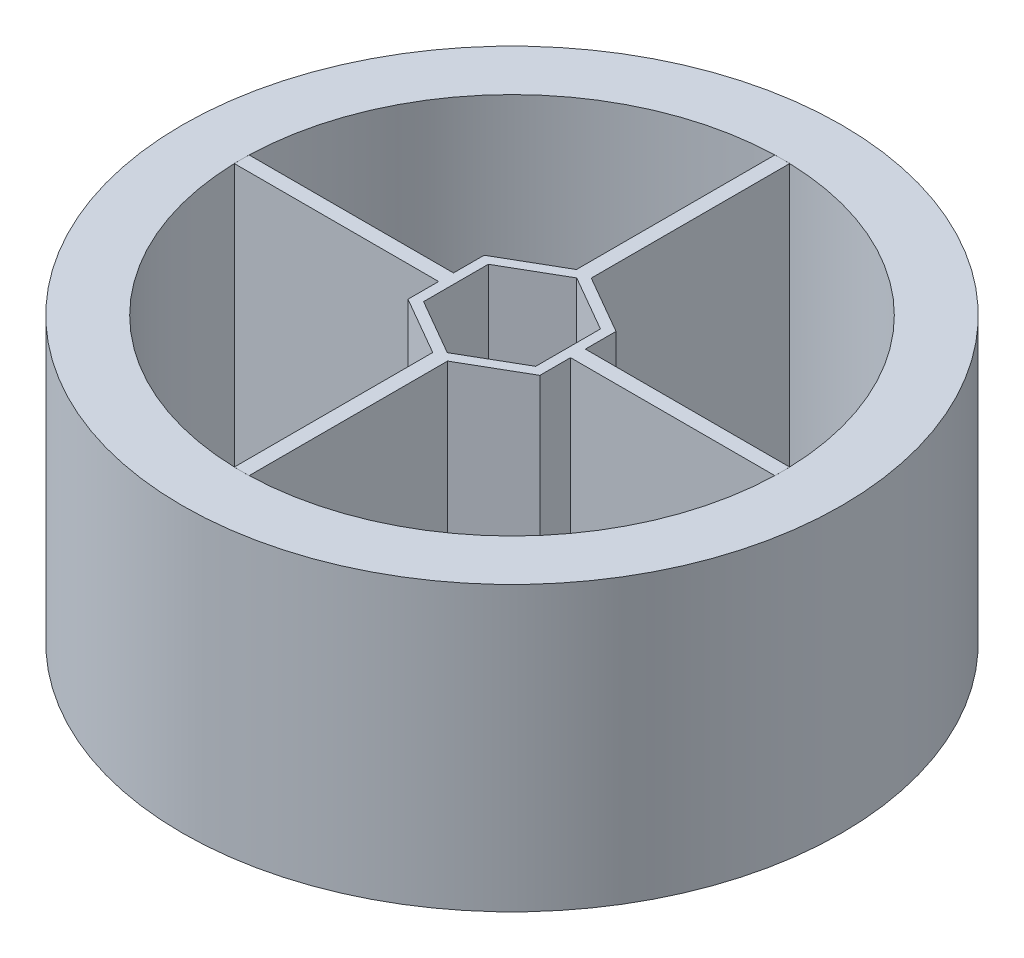
from build123d import *

# Parameters (mm, degrees)
MAIN_WHEEL_DEPTH   = 43
SKETCH1_R          = 50
MAIN_WHEEL_2_DEPTH = 43
HEX_BORE_DEPTH     = 23
SKETCH3_R          = 2.5
MOTOR_BORE_DEPTH   = 75.35724578


with BuildPart() as part:
    # Sketch1 → main-wheel (new body)
    with BuildSketch(Plane(origin=(0, 0, 0), x_dir=(1, 0, 0), z_dir=(0, 1, 0))):
        with BuildLine():
            Line((-1.125, -10.897486331), (-1.125, -40.984562643))
            ThreePointArc((-1.125, -40.984562643), (-0.562552934, -40.996140479), (4.4e-08, -41))
            ThreePointArc((4.4e-08, -41), (0.562552978, -40.996140479), (1.125, -40.984562643))
            Line((1.125, -40.984562643), (1.125, -10.897486331))
            Line((1.125, -10.897486331), (10, -5.773502692))
            Line((10, -5.773502692), (10, -1.125))
            Line((10, -1.125), (40.984562643, -1.125))
            ThreePointArc((40.984562643, -1.125), (40.996140479, -0.562552956), (41, 0))
            ThreePointArc((41, 0), (40.996140479, 0.562552956), (40.984562643, 1.125))
            Line((40.984562643, 1.125), (10, 1.125))
            Line((10, 1.125), (10, 5.773502692))
            Line((10, 5.773502692), (1.125, 10.897486331))
            Line((1.125, 10.897486331), (1.125, 40.984562643))
            ThreePointArc((1.125, 40.984562643), (0.562552956, 40.996140479), (0, 41))
            ThreePointArc((0, 41), (-0.562552956, 40.996140479), (-1.125, 40.984562643))
            Line((-1.125, 40.984562643), (-1.125, 10.897486331))
            Line((-1.125, 10.897486331), (-10, 5.773502692))
            Line((-10, 5.773502692), (-10, 1.125))
            Line((-10, 1.125), (-40.984562643, 1.125))
            ThreePointArc((-40.984562643, 1.125), (-40.996140481, 0.562552814), (-41, -2.83e-07))
            ThreePointArc((-41, -2.83e-07), (-40.996140477, -0.562553097), (-40.984562643, -1.125))
            Line((-40.984562643, -1.125), (-10, -1.125))
            Line((-10, -1.125), (-10, -5.773502692))
            Line((-10, -5.773502692), (-1.125, -10.897486331))
        make_face()
    extrude(amount=MAIN_WHEEL_DEPTH)

    # Sketch2 → hex-bore (cut)
    with BuildSketch(Plane(origin=(0, 43, 0), x_dir=(1, 0, 0), z_dir=(0, 1, 0))):
        Polygon((0, -9.814954576), (8.5, -4.907477288), (8.5, 4.907477288), (0, 9.814954576), (-8.5, 4.907477288), (-8.5, -4.907477288), align=None)
    extrude(amount=-HEX_BORE_DEPTH, mode=Mode.SUBTRACT)

    # Sketch3 → motor-bore (cut, through all)
    with BuildSketch(Plane(origin=(0, 20, 0), x_dir=(1, 0, 0), z_dir=(0, 1, 0))):
        with Locations(Location((0, 0, 0), (0, 0, 270))):
            Circle(SKETCH3_R)
    extrude(amount=-MOTOR_BORE_DEPTH, mode=Mode.SUBTRACT)


with BuildPart() as body_2:
    # Sketch1 → main-wheel 2 (new body)
    with BuildSketch(Plane(origin=(0, 0, 0), x_dir=(1, 0, 0), z_dir=(0, 1, 0))):
        with Locations(Location((0, 0, 0), (0, 0, 270))):
            Circle(SKETCH1_R)
        with BuildLine():
            Line((4.4e-08, -41), (-1.125, -41))
            Line((-1.125, -41), (-1.125, -40.984562643))
            ThreePointArc((-1.125, -40.984562643), (-28.991378029, -28.991378029), (-40.984562643, -1.125))
            Line((-40.984562643, -1.125), (-41, -1.125))
            Line((-41, -1.125), (-41, -2.83e-07))
            Line((-41, -2.83e-07), (-41, 1.125))
            Line((-41, 1.125), (-40.984562643, 1.125))
            ThreePointArc((-40.984562643, 1.125), (-28.991378029, 28.991378029), (-1.125, 40.984562643))
            Line((-1.125, 40.984562643), (-1.125, 41))
            Line((-1.125, 41), (0, 41))
            Line((0, 41), (1.125, 41))
            Line((1.125, 41), (1.125, 40.984562643))
            ThreePointArc((1.125, 40.984562643), (28.991378029, 28.991378029), (40.984562643, 1.125))
            Line((40.984562643, 1.125), (41, 1.125))
            Line((41, 1.125), (41, 0))
            Line((41, 0), (41, -1.125))
            Line((41, -1.125), (40.984562643, -1.125))
            ThreePointArc((40.984562643, -1.125), (28.991378029, -28.991378029), (1.125, -40.984562643))
            Line((1.125, -40.984562643), (1.125, -41))
            Line((1.125, -41), (4.4e-08, -41))
        make_face(mode=Mode.SUBTRACT)
    extrude(amount=MAIN_WHEEL_2_DEPTH)


solid = Compound([part.part, body_2.part])
